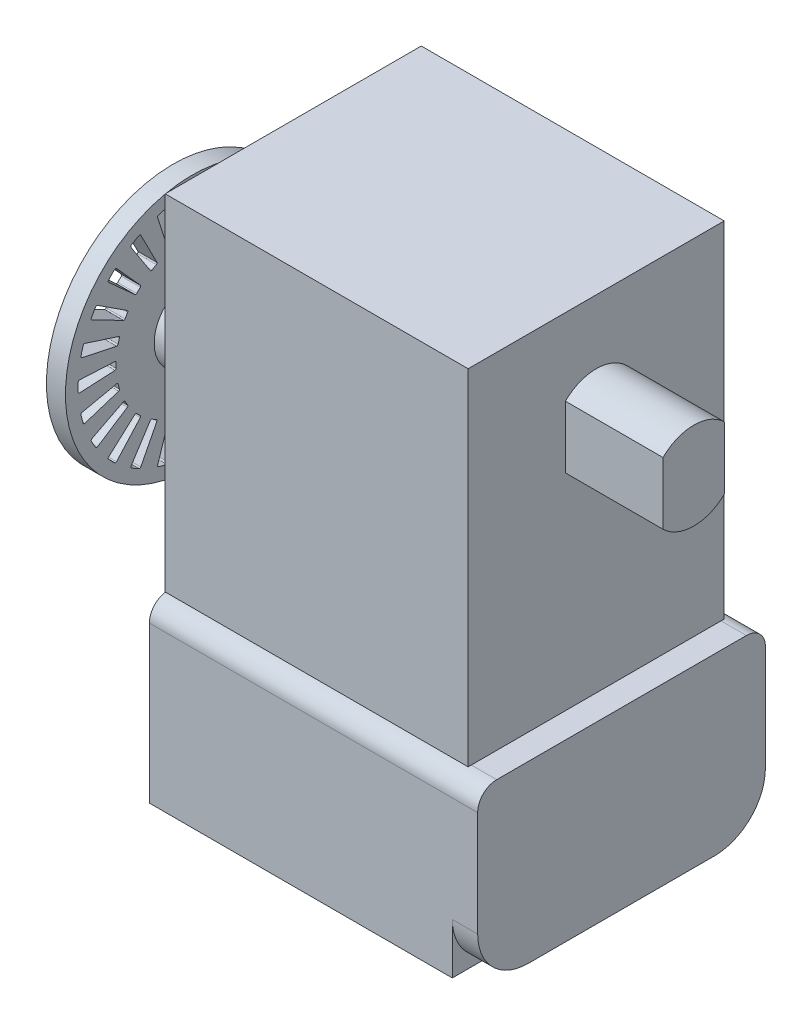
from build123d import *

# Parameters (mm, degrees)
ESQUISSE1_W                  = 25.1
ESQUISSE1_H                  = 27.2
EXTRUSION1_DEPTH             = 20.2
EXTRUSION2_DEPTH             = 25.1
ESQUISSE9_W                  = 1.2
ESQUISSE9_H                  = 50.912043881
ENL_V_MAT_EXTRU_2_DEPTH      = 44.418198949
EXTRUSION3_DEPTH             = 2
EXTRUSION4_DEPTH             = 7.7
ESQUISSE6_R                  = 1.25
EXTRUSION5_DEPTH             = 10
ENL_V_MAT_EXTRU_1_REACH      = 55.728
R_P_TITION_CIRCULAIRE1_COUNT = 24


with BuildPart() as part:
    # Esquisse1 → Extrusion1 (new body)
    with BuildSketch(Plane.XY):
        with Locations((12.55, 13.6)):
            Rectangle(ESQUISSE1_W, ESQUISSE1_H)
    extrude(amount=EXTRUSION1_DEPTH)

    # Esquisse2 → Extrusion2 (add)
    with BuildSketch(Plane.ZY):
        with BuildLine():
            Line((0.25, 0), (19.95, 0))
            ThreePointArc((19.95, 0), (21.010660172, -0.439339828), (21.45, -1.5))
            Line((21.45, -1.5), (21.45, -13.8))
            Line((21.45, -13.8), (-1.25, -13.8))
            Line((-1.25, -13.8), (-1.25, -1.5))
            ThreePointArc((-1.25, -1.5), (-0.810660172, -0.439339828), (0.25, 0))
        make_face()
    extrude(amount=-EXTRUSION2_DEPTH)

    # Esquisse9 → Enlèv. mat.-Extru.2 (cut, through all)
    with BuildSketch(Plane.XY.offset(21.45)):
        with Locations((0.6, 11.656021941)):
            Rectangle(ESQUISSE9_W, ESQUISSE9_H)
    extrude(amount=-ENL_V_MAT_EXTRU_2_DEPTH, mode=Mode.SUBTRACT)

    # Esquisse4 → Extrusion3 (add)
    with BuildSketch(Plane(origin=(25.1, 0, 0), x_dir=(0, 0, -1), z_dir=(1, 0, 0))):
        with BuildLine():
            Line((1.25, -9.8), (1.25, -1.5))
            ThreePointArc((1.25, -1.5), (0.810660172, -0.439339828), (-0.25, 0))
            Line((-0.25, 0), (-19.95, 0))
            ThreePointArc((-19.95, 0), (-21.010660172, -0.439339828), (-21.45, -1.5))
            Line((-21.45, -1.5), (-21.45, -9.8))
            ThreePointArc((-21.45, -9.8), (-20.278427125, -12.628427125), (-17.45, -13.8))
            Line((-17.45, -13.8), (-2.75, -13.8))
            ThreePointArc((-2.75, -13.8), (0.078427125, -12.628427125), (1.25, -9.8))
        make_face()
    extrude(amount=EXTRUSION3_DEPTH)

    # Esquisse5 → Extrusion4 (add)
    with BuildSketch(Plane(origin=(25.1, 0, 0), x_dir=(0, 0, -1), z_dir=(1, 0, 0))):
        with BuildLine():
            Line((-12.52899156, 21.15), (-12.52899156, 16.25))
            ThreePointArc((-12.52899156, 16.25), (-10.1, 15.25), (-7.67100844, 16.25))
            Line((-7.67100844, 16.25), (-7.67100844, 21.15))
            ThreePointArc((-7.67100844, 21.15), (-10.1, 22.15), (-12.52899156, 21.15))
        make_face()
    extrude(amount=EXTRUSION4_DEPTH)

    # Esquisse6 → Extrusion5 (add)
    with BuildSketch(Plane.ZY.offset(-1.2)):
        with Locations(Location((10.1, 9.45, 0), (0, 0, 180))):
            Circle(ESQUISSE6_R)
    extrude(amount=EXTRUSION5_DEPTH)

    # Esquisse7 → Révolution1 (revolve)
    with BuildSketch(Plane.XY.offset(10.1), mode=Mode.PRIVATE) as r_volution1_sk:
        Polygon((-8.27, 10.7), (-8.27, 19.45), (-6.77, 19.45), (-6.77, 12.45), (-2.27, 12.45), (-2.27, 10.7), align=None)
    revolve(r_volution1_sk.sketch.rotate(Axis((1.2, 9.45, 10.1), (-1, 0, 0)), 90), axis=Axis((1.2, 9.45, 10.1), (-1, 0, 0)))

    # Esquisse8 → Enlèv. mat.-Extru.1 (cut, up to next)
    with BuildSketch(Plane.ZY.offset(8.27), mode=Mode.PRIVATE) as enl_v_mat_extru_1_sk1:
        with BuildLine():
            Line((9.796978978, 15.541549664), (9.65509852, 18.338242893))
            ThreePointArc((9.65509852, 18.338242893), (9.681168123, 18.410787455), (9.751093343, 18.443234354))
            ThreePointArc((9.751093343, 18.443234354), (10.1, 18.45), (10.448906657, 18.443234354))
            ThreePointArc((10.448906657, 18.443234354), (10.518831877, 18.410787455), (10.54490148, 18.338242893))
            Line((10.54490148, 18.338242893), (10.403021022, 15.541549664))
            ThreePointArc((10.403021022, 15.541549664), (10.370828899, 15.472999091), (10.299819139, 15.44667177))
            ThreePointArc((10.299819139, 15.44667177), (10.1, 15.45), (9.900180861, 15.44667177))
            ThreePointArc((9.900180861, 15.44667177), (9.829171101, 15.472999091), (9.796978978, 15.541549664))
        make_face()
    enl_v_mat_extru_1_tool1 = extrude(enl_v_mat_extru_1_sk1.sketch, amount=-ENL_V_MAT_EXTRU_1_REACH, mode=Mode.PRIVATE) & part.part
    enl_v_mat_extru_1 = enl_v_mat_extru_1_tool1.solids().sort_by_distance((-8.27, 17.048727, 10.1))[0]
    add(enl_v_mat_extru_1, mode=Mode.SUBTRACT)

    # Répétition circulaire1: Enlèv. mat.-Extru.1 ×24 about axis
    r_p_tition_circulaire1_axis = Axis((0, 9.45, 10.1), (1, 0, 0))
    for i in range(1, R_P_TITION_CIRCULAIRE1_COUNT):
        add(enl_v_mat_extru_1.rotate(r_p_tition_circulaire1_axis, i * 360 / R_P_TITION_CIRCULAIRE1_COUNT), mode=Mode.SUBTRACT)


solid = part.part
